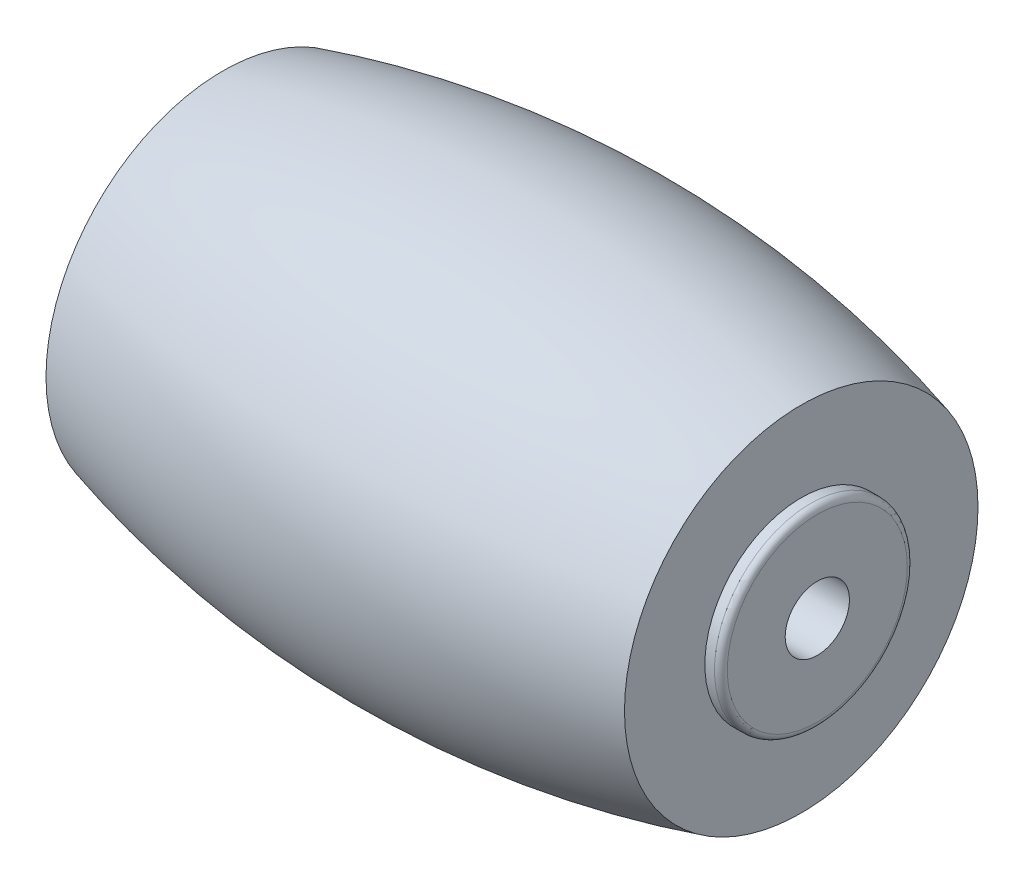
from build123d import *

# Parameters (mm, degrees)
SKETCH3_R           = 3
BOSS_EXTRUDE1_DEPTH = 0.5
SKETCH4_R           = 1
CUT_EXTRUDE2_DEPTH  = 22.251203514
FILLET1_R           = 0.2


with BuildPart() as part:
    # Sketch1 → Revolve1 (revolve)
    with BuildSketch(Plane(origin=(0, 0, 0), x_dir=(1, 0, 0), z_dir=(0, 1, 0))):
        with BuildLine():
            Line((0, 0), (-9, 0))
            Line((-9, 0), (-9, 5.5))
            ThreePointArc((-9, 5.5), (0, 6.731034397), (9, 5.5))
            Line((9, 5.5), (9, 0))
            Line((9, 0), (0, 0))
        make_face()
    revolve(axis=Axis((0, 0, 0), (-1, 0, 0)))

    # Sketch3 → Boss-Extrude1 (add)
    with BuildSketch(Plane(origin=(9, 0, 0), x_dir=(0, 0, -1), z_dir=(1, 0, 0))):
        Circle(SKETCH3_R)
    boss_extrude1 = extrude(amount=BOSS_EXTRUDE1_DEPTH)

    # Mirror1: Boss-Extrude1 across plane
    add(boss_extrude1.mirror(Plane(origin=(0, 0, 0), x_dir=(0, 0, 1), z_dir=(1, 0, 0))))

    # Sketch4 → Cut-Extrude2 (cut, through all)
    with BuildSketch(Plane.ZY.offset(9.5)):
        Circle(SKETCH4_R)
    extrude(amount=-CUT_EXTRUDE2_DEPTH, mode=Mode.SUBTRACT)

    # Fillet1
    fillet1_edges = [part.edges().sort_by_distance(p)[0] for p in [
        (9.5, 0, 3),
        (-9.5, 0, 3),
    ]]
    fillet(fillet1_edges, radius=FILLET1_R)


solid = part.part
